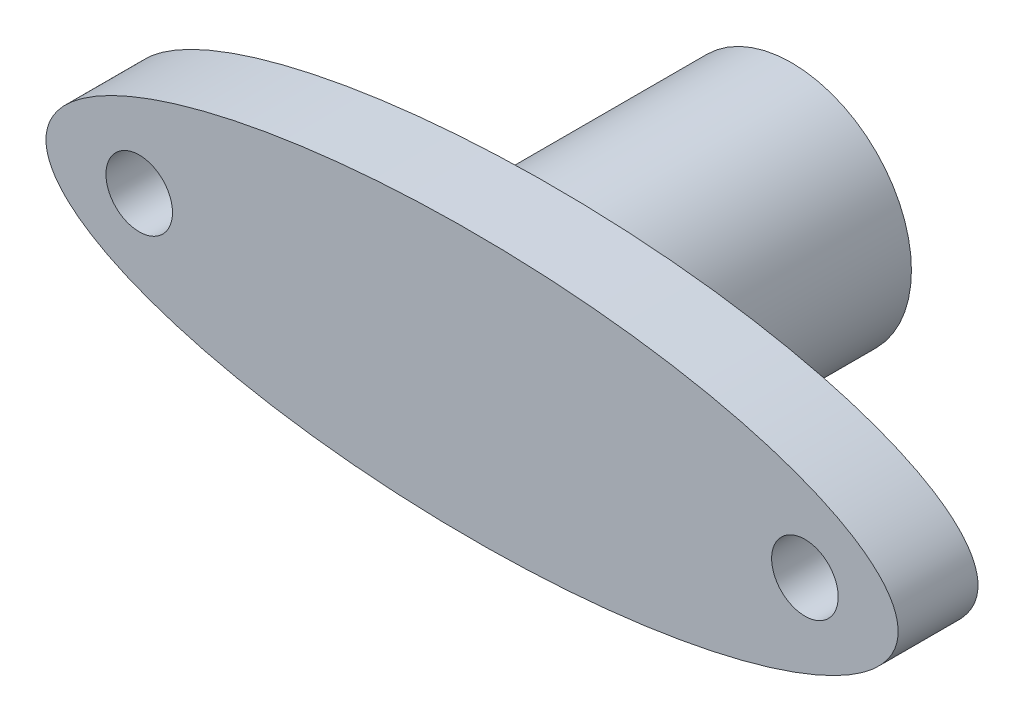
from build123d import *

# Parameters (mm, degrees)
SALIENTE_EXTRUIR1_DEPTH   = 0.15
CROQUIS1_R                = 0.0625
CROQUIS1_R_2              = 0.225
SALIENTE_EXTRUIR1_2_DEPTH = 0.15
CROQUIS1_5_R              = 0.225
SALIENTE_EXTRUIR2_DEPTH   = 0.45
CROQUIS1_6_R              = 0.225
SALIENTE_EXTRUIR3_DEPTH   = 0.15
CROQUIS1_8_R              = 0.225
SALIENTE_EXTRUIR5_DEPTH   = 0.15


with BuildPart() as part:
    # Croquis1 → Saliente-Extruir1 (new body)
    with BuildSketch(Plane.XY):
        Polygon((0.072168784, -0.125), (0.144337567, 0), (0.072168784, 0.125), (-0.072168784, 0.125), (-0.144337567, 0), (-0.072168784, -0.125), align=None)
    extrude(amount=SALIENTE_EXTRUIR1_DEPTH)



with BuildPart() as body_2:
    # Croquis1 → Saliente-Extruir1 2 (new body)
    with BuildSketch(Plane.XY):
        with BuildLine():
            add(Edge.make_bspline(
                [(-0.8, 0), (-0.8, -0.433012702), (0.4, -0.216506351), (1.6, 0), (0.4, 0.216506351), (-0.8, 0.433012702), (-0.8, 0)],
                knots=[0, 0, 0, 2.094395102, 2.094395102, 4.188790205, 4.188790205, 6.283185307, 6.283185307, 6.283185307], degree=2, weights=[1, 0.5, 1, 0.5, 1, 0.5, 1]))
        make_face()
        with Locations((-0.625, 0)):
            Circle(CROQUIS1_R, mode=Mode.SUBTRACT)
        Circle(CROQUIS1_R_2, mode=Mode.SUBTRACT)
        with Locations((0.625, 0)):
            Circle(CROQUIS1_R, mode=Mode.SUBTRACT)
    extrude(amount=SALIENTE_EXTRUIR1_2_DEPTH)


with BuildPart() as body_3:
    # Croquis1<5> → Saliente-Extruir2 (new body)
    with BuildSketch(Plane.XY):
        Circle(CROQUIS1_5_R)
        Polygon((0.072168784, 0.125), (0.144337567, 0), (0.072168784, -0.125), (-0.072168784, -0.125), (-0.144337567, 0), (-0.072168784, 0.125), align=None, mode=Mode.SUBTRACT)
    extrude(amount=-SALIENTE_EXTRUIR2_DEPTH)


with BuildPart() as part_1:
    add(part.part)

    add(body_2.part)  # Saliente-Extruir3 merges body 2

    add(body_3.part)  # Saliente-Extruir3 merges body 3
    # Croquis1<6> → Saliente-Extruir3 (add)
    with BuildSketch(Plane.XY):
        Circle(CROQUIS1_6_R)
        Polygon((0.072168784, 0.125), (0.144337567, 0), (0.072168784, -0.125), (-0.072168784, -0.125), (-0.144337567, 0), (-0.072168784, 0.125), align=None, mode=Mode.SUBTRACT)
    extrude(amount=SALIENTE_EXTRUIR3_DEPTH)

    # Croquis1<8> → Saliente-Extruir5 (add)
    with BuildSketch(Plane.XY):
        Circle(CROQUIS1_8_R)
    extrude(amount=-SALIENTE_EXTRUIR5_DEPTH)


solid = part_1.part
